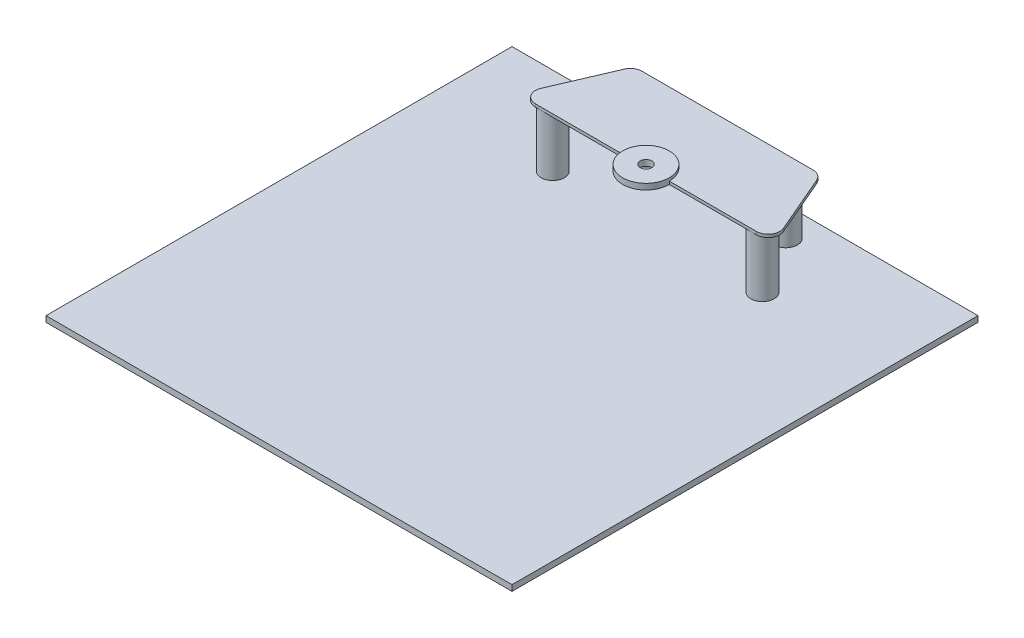
from build123d import *

# Parameters (mm, degrees)
SKETCH1_W                = 800
SKETCH1_H                = 800
BOSS_EXTRUDE4_DEPTH      = 10
SKETCH6_R                = 20
BOSS_EXTRUDE5_DEPTH      = 100
BOSS_EXTRUDE6_DEPTH      = 5
BOSS_EXTRUDE7_DEPTH      = 5
BOSS_EXTRUDE7_DEPTH_BACK = 5
SKETCH8_R                = 40
CUT_EXTRUDE1_DEPTH       = 5
CUT_EXTRUDE1_DEPTH_BACK  = 24
SKETCH9_R                = 10


with BuildPart() as part:
    # Sketch1 → Boss-Extrude4 (new body)
    with BuildSketch(Plane(origin=(0, 0, 0), x_dir=(1, 0, 0), z_dir=(0, 1, 0))):
        Rectangle(SKETCH1_W, SKETCH1_H)
    extrude(amount=BOSS_EXTRUDE4_DEPTH)

    # Sketch6 → Boss-Extrude5 (add)
    with BuildSketch(Plane(origin=(0, 10, 0), x_dir=(1, 0, 0), z_dir=(0, 1, 0))):
        with Locations(Location((120, 350, 0), (0, 0, 270))):
            Circle(SKETCH6_R)
        with Locations(Location((-120, 350, 0), (0, 0, 270))):
            Circle(SKETCH6_R)
        with Locations(Location((-180, 250, 0), (0, 0, 270))):
            Circle(SKETCH6_R)
        with Locations(Location((180, 250, 0), (0, 0, 270))):
            Circle(SKETCH6_R)
    extrude(amount=BOSS_EXTRUDE5_DEPTH)

    # Sketch7 → Boss-Extrude6 (add)
    with BuildSketch(Plane(origin=(0, 110, 0), x_dir=(1, 0, 0), z_dir=(0, 1, 0))):
        with BuildLine():
            Line((-120, 370), (120, 370))
            Line((120, 370), (146.81207684, 370))
            ThreePointArc((146.81207684, 370), (157.821897015, 366.696821845), (165.194977441, 357.878385972))
            Line((165.194977441, 357.878385972), (208.052120298, 257.878385972))
            ThreePointArc((208.052120298, 257.878385972), (206.366041542, 238.990179825), (189.669219698, 230))
            Line((189.669219698, 230), (180, 230))
            Line((180, 230), (-180, 230))
            Line((-180, 230), (-189.669219698, 230))
            ThreePointArc((-189.669219698, 230), (-206.366041542, 238.990179825), (-208.052120298, 257.878385972))
            Line((-208.052120298, 257.878385972), (-165.194977441, 357.878385972))
            ThreePointArc((-165.194977441, 357.878385972), (-157.821897015, 366.696821845), (-146.81207684, 370))
            Line((-146.81207684, 370), (-120, 370))
        make_face()
    extrude(amount=BOSS_EXTRUDE6_DEPTH)

    # Sketch8 → Boss-Extrude7 (add, two sides: drawn at the far end of the back side and taken through both)
    with BuildSketch(Plane(origin=(0, 115, 0), x_dir=(1, 0, 0), z_dir=(0, 1, 0)).offset(-BOSS_EXTRUDE7_DEPTH_BACK)):
        with Locations(Location((0, 230, 0), (0, 0, 270))):
            Circle(SKETCH8_R)
    extrude(amount=BOSS_EXTRUDE7_DEPTH + BOSS_EXTRUDE7_DEPTH_BACK)

    # Sketch9 → Cut-Extrude1 (cut, two sides: drawn at the far end of the back side and taken through both)
    with BuildSketch(Plane(origin=(0, 120, 0), x_dir=(1, 0, 0), z_dir=(0, 1, 0)).offset(-CUT_EXTRUDE1_DEPTH_BACK)):
        with Locations(Location((0, 230, 0), (0, 0, 90))):
            Circle(SKETCH9_R)
    extrude(amount=CUT_EXTRUDE1_DEPTH + CUT_EXTRUDE1_DEPTH_BACK, mode=Mode.SUBTRACT)


solid = part.part
